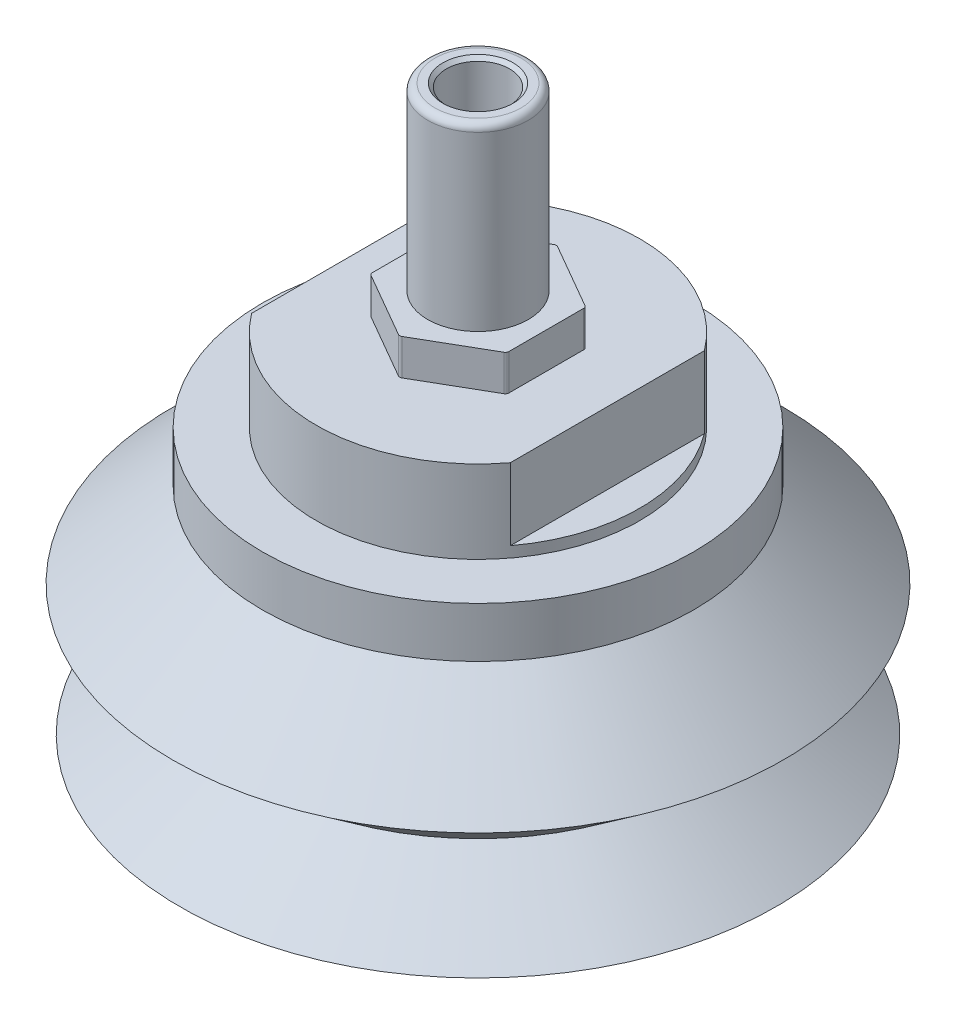
from build123d import *

# Parameters (mm, degrees)
HOLE_WIZARD_G1_8_1_D           = 8.8
HOLE_WIZARD_G1_8_1_CSINK_D     = 9.778
HOLE_WIZARD_G1_8_1_CSINK_ANGLE = 90
FILLET_1_R                     = 1
SKETCH_5_W                     = 32.896271037
SKETCH_5_H                     = 64.386050675
CUT_EXTRUDE_1_DEPTH            = 10
SKETCH_6_R                     = 4.4
EXTRUDE_1_DEPTH                = 5
FILLET_2_R                     = 0.5


with BuildPart() as part:
    # 草图1 → 旋转2 (revolve)
    with BuildSketch(Plane.XY, mode=Mode.PRIVATE) as revolve_2_sk:
        Polygon((-40.5, 0), (-41.5, 0), (-30, 8.651787717), (-42.5, 18.178475316), (-30, 30), (-30, 37), (-22.5, 37), (-22.5, 48.5), (-7, 48.5), (-7, 78.5), (0, 78.5), (0, 30), (-29, 30), (-41.5, 18.178475316), (-29, 8.651787717), align=None)
    revolve(revolve_2_sk.sketch.rotate(Axis((0, 0, 0), (0, 1, 0)), 270), axis=Axis((0, 0, 0), (0, 1, 0)))

    # G1/8 螺纹孔1 (through all)
    with Locations(Plane(origin=(0, 78.5, 0), x_dir=(1, 0, 0), z_dir=(0, 1, 0))):
        with Locations((0, 0)):
            CounterSinkHole(HOLE_WIZARD_G1_8_1_D / 2, HOLE_WIZARD_G1_8_1_CSINK_D / 2, counter_sink_angle=HOLE_WIZARD_G1_8_1_CSINK_ANGLE)

    # 圆角1
    fillet_1_edges = [part.edges().sort_by_distance(p)[0] for p in [
        (0, 78.5, 7),
    ]]
    fillet(fillet_1_edges, radius=FILLET_1_R)

    # 草图5 → 切除-拉伸1 (cut)
    with BuildSketch(Plane(origin=(0, 48.5, 0), x_dir=(1, 0, 0), z_dir=(0, 1, 0))):
        with Locations((-34.448135519, 0.195346028)):
            Rectangle(SKETCH_5_W, SKETCH_5_H)
        with Locations((34.448135519, 0.195346028)):
            Rectangle(SKETCH_5_W, SKETCH_5_H)
    extrude(amount=-CUT_EXTRUDE_1_DEPTH, mode=Mode.SUBTRACT)

    # 草图6 → 凸台-拉伸1 (add)
    with BuildSketch(Plane(origin=(0, 48.5, 0), x_dir=(1, 0, 0), z_dir=(0, 1, 0))):
        Polygon((0, 10.969655115), (-9.5, 5.484827557), (-9.5, -5.484827557), (0, -10.969655115), (9.5, -5.484827557), (9.5, 5.484827557), align=None)
        with Locations(Location((0, 0, 0), (0, 0, 270))):
            Circle(SKETCH_6_R, mode=Mode.SUBTRACT)
    extrude(amount=EXTRUDE_1_DEPTH)

    # 圆角2
    fillet_2_edges = [part.edges().sort_by_distance(p)[0] for p in [
        (9.5, 51, -5.484827557),
        (0, 51, -10.969655115),
        (-9.5, 51, -5.484827557),
        (-9.5, 51, 5.484827557),
        (0, 51, 10.969655115),
        (9.5, 51, 5.484827557),
    ]]
    fillet(fillet_2_edges, radius=FILLET_2_R)


solid = part.part
